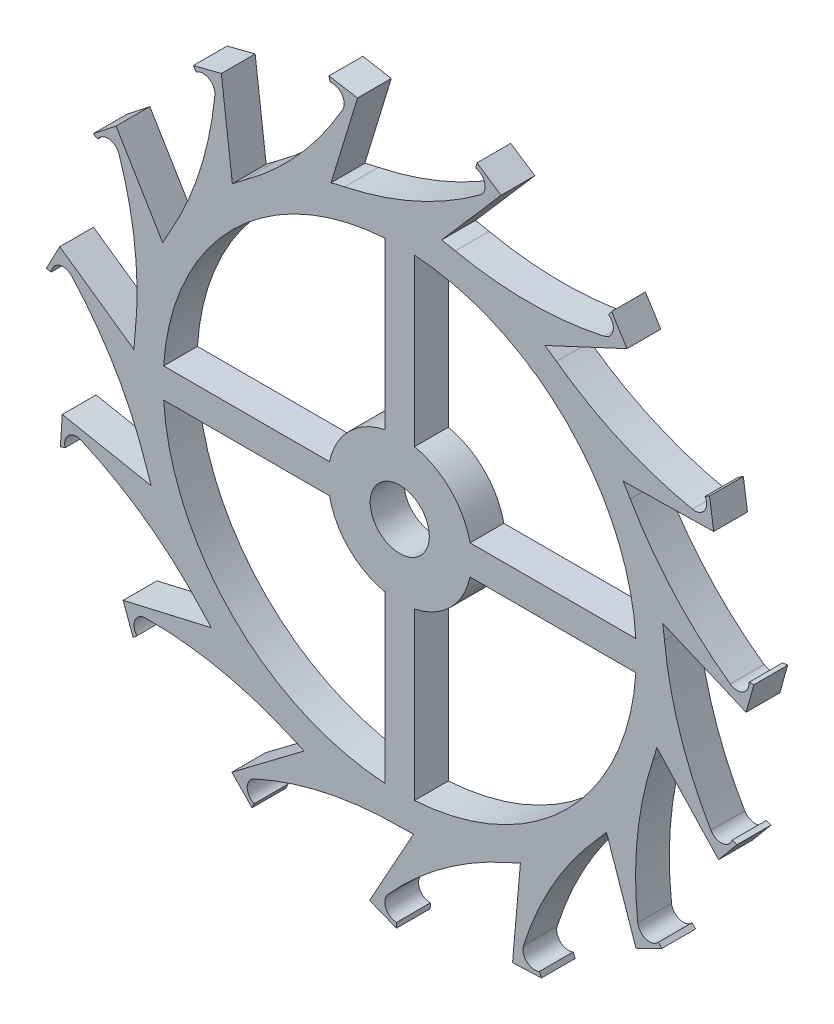
from build123d import *

# Parameters (mm, degrees)
SKETCH1_R           = 0.35
BOSS_EXTRUDE1_DEPTH = 0.4


with BuildPart() as part:
    # Sketch1 → Boss-Extrude1 (new body)
    with BuildSketch(Plane.XY):
        with BuildLine():
            Line((1.717219809, 2.640768094), (2.689842019, 3.094309279))
            Line((2.689842019, 3.094309279), (2.507060643, 3.38396102))
            Line((2.507060643, 3.38396102), (2.4713431, 3.33575047))
            ThreePointArc((2.4713431, 3.33575047), (2.524919075, 3.194040009), (2.418160882, 3.086546159))
            ThreePointArc((2.418160882, 3.086546159), (1.538245687, 2.989134777), (0.657689973, 3.080575255))
            ThreePointArc((0.657689973, 3.080575255), (0.576375294, 3.096819581), (0.494661207, 3.110917918))
            Line((0.494661207, 3.110917918), (1.198723989, 3.920849499))
            Line((1.198723989, 3.920849499), (0.913932917, 4.111115649))
            Line((0.913932917, 4.111115649), (0.900912315, 4.052545486))
            ThreePointArc((0.900912315, 4.052545486), (1.007495241, 3.94487785), (0.953688466, 3.803254863))
            ThreePointArc((0.953688466, 3.803254863), (0.189466715, 3.356371385), (-0.65215315, 3.081752143))
            ThreePointArc((-0.65215315, 3.081752143), (-0.733044969, 3.063518414), (-0.813428812, 3.043161771))
            Line((-0.813428812, 3.043161771), (-0.499664308, 4.069439222))
            Line((-0.499664308, 4.069439222), (-0.837222113, 4.127421033))
            Line((-0.837222113, 4.127421033), (-0.825294394, 4.068618571))
            ThreePointArc((-0.825294394, 4.068618571), (-0.684133674, 4.013610473), (-0.675685349, 3.862346249))
            ThreePointArc((-0.675685349, 3.862346249), (-1.192072773, 3.143260888), (-1.84923307, 2.550066088))
            ThreePointArc((-1.84923307, 2.550066088), (-1.915715097, 2.500507082), (-1.9808696, 2.449215309))
            Line((-1.9808696, 2.449215309), (-2.111656107, 3.514385933))
            Line((-2.111656107, 3.514385933), (-2.443613834, 3.430057825))
            Line((-2.443613834, 3.430057825), (-2.408800204, 3.381190544))
            ThreePointArc((-2.408800204, 3.381190544), (-2.25746966, 3.388353383), (-2.18822703, 3.253602881))
            ThreePointArc((-2.18822703, 3.253602881), (-2.367492049, 2.386652029), (-2.726563791, 1.577450441))
            ThreePointArc((-2.726563791, 1.577450441), (-2.767140682, 1.505135359), (-2.805800038, 1.431777269))
            Line((-2.805800038, 1.431777269), (-3.358523382, 2.351663389))
            Line((-3.358523382, 2.351663389), (-3.627482524, 2.139606457))
            Line((-3.627482524, 2.139606457), (-3.575802576, 2.109123954))
            ThreePointArc((-3.575802576, 2.109123954), (-3.440468635, 2.17721921), (-3.322404377, 2.082282016))
            ThreePointArc((-3.322404377, 2.082282016), (-3.133550441, 1.217369352), (-3.132446863, 0.332079281))
            ThreePointArc((-3.132446863, 0.332079281), (-3.140102504, 0.249512058), (-3.14558216, 0.166771932))
            Line((-3.14558216, 0.166771932), (-4.024671452, 0.782316881))
            Line((-4.024671452, 0.782316881), (-4.18412653, 0.479197696))
            Line((-4.18412653, 0.479197696), (-4.124516198, 0.472370671))
            ThreePointArc((-4.124516198, 0.472370671), (-4.028579326, 0.589624057), (-3.882107824, 0.550915675))
            ThreePointArc((-3.882107824, 0.550915675), (-3.357789496, -0.162407546), (-2.996701415, -0.970711403))
            ThreePointArc((-2.996701415, -0.970711403), (-2.970112076, -1.049254144), (-2.941464549, -1.127069787))
            Line((-2.941464549, -1.127069787), (-3.994917266, -0.922299323))
            Line((-3.994917266, -0.922299323), (-4.017297048, -1.264068701))
            Line((-4.017297048, -1.264068701), (-3.960063499, -1.246059791))
            ThreePointArc((-3.960063499, -1.246059791), (-3.920112054, -1.099922453), (-3.770559561, -1.075708992))
            ThreePointArc((-3.770559561, -1.075708992), (-3.001436241, -1.514102704), (-2.342799068, -2.105657267))
            ThreePointArc((-2.342799068, -2.105657267), (-2.286562287, -2.166594772), (-2.228740996, -2.226030901))
            Line((-2.228740996, -2.226030901), (-3.274405591, -2.467441595))
            Line((-3.274405591, -2.467441595), (-3.15584041, -2.788766135))
            Line((-3.15584041, -2.788766135), (-3.110879844, -2.749035196))
            ThreePointArc((-3.110879844, -2.749035196), (-3.133821794, -2.599282378), (-3.007047295, -2.516333802))
            ThreePointArc((-3.007047295, -2.516333802), (-2.126107394, -2.603995748), (-1.283805479, -2.87651586))
            ThreePointArc((-1.283805479, -2.87651586), (-1.207645106, -2.909311482), (-1.130647877, -2.940091049))
            Line((-1.130647877, -2.940091049), (-1.987719443, -3.585940799))
            Line((-1.987719443, -3.585940799), (-1.748710296, -3.83126057))
            Line((-1.748710296, -3.83126057), (-1.723796804, -3.776677441))
            ThreePointArc((-1.723796804, -3.776677441), (-1.805665276, -3.649202766), (-1.723589234, -3.521861637))
            ThreePointArc((-1.723589234, -3.521861637), (-0.883155263, -3.243634272), (-0.002830259, -3.149998729))
            ThreePointArc((-0.002830259, -3.149998729), (0.080084884, -3.148981805), (0.162944532, -3.145782745))
            Line((0.162944532, -3.145782745), (-0.357338545, -4.084398262))
            Line((-0.357338545, -4.084398262), (-0.039212284, -4.211295246))
            Line((-0.039212284, -4.211295246), (-0.038653636, -4.151297847))
            ThreePointArc((-0.038653636, -4.151297847), (-0.165292828, -4.068142844), (-0.142106936, -3.9184276))
            ThreePointArc((-0.142106936, -3.9184276), (0.512502436, -3.322418962), (1.278634338, -2.8788182))
            ThreePointArc((1.278634338, -2.8788182), (1.353967471, -2.844164568), (1.42836235, -2.807540026))
            Line((1.42836235, -2.807540026), (1.334829433, -3.87662616))
            Line((1.334829433, -3.87662616), (1.677065887, -3.863158716))
            Line((1.677065887, -3.863158716), (1.653173097, -3.808121141))
            ThreePointArc((1.653173097, -3.808121141), (1.503660251, -3.783664066), (1.463946943, -3.637461833))
            ThreePointArc((1.463946943, -3.637461833), (1.819543808, -2.826727231), (2.339011442, -2.109863852))
            ThreePointArc((2.339011442, -2.109863852), (2.393736781, -2.047565438), (2.446803342, -1.98384813))
            Line((2.446803342, -1.98384813), (2.796193276, -2.998550177))
            Line((2.796193276, -2.998550177), (3.103364131, -2.847046948))
            Line((3.103364131, -2.847046948), (3.059151183, -2.806485695))
            ThreePointArc((3.059151183, -2.806485695), (2.912616813, -2.844955398), (2.816871095, -2.72754587))
            ThreePointArc((2.816871095, -2.72754587), (2.811969526, -1.842268681), (2.994952219, -0.976094876))
            ThreePointArc((2.994952219, -0.976094876), (3.019607256, -0.896923642), (3.042169808, -0.81713087))
            Line((3.042169808, -0.81713087), (3.774069899, -1.601997627))
            Line((3.774069899, -1.601997627), (3.993062523, -1.338654898))
            Line((3.993062523, -1.338654898), (3.936174238, -1.319583375))
            ThreePointArc((3.936174238, -1.319583375), (3.817955468, -1.414328096), (3.682732645, -1.346012447))
            ThreePointArc((3.682732645, -1.346012447), (3.318180166, -0.53926514), (3.133038549, 0.326449772))
            ThreePointArc((3.133038549, 0.326449772), (3.123360204, 0.4088044), (3.111517477, 0.490875741))
            Line((3.111517477, 0.490875741), (4.09937555, 0.071554866))
            Line((4.09937555, 0.071554866), (4.19232413, 0.401202745))
            Line((4.19232413, 0.401202745), (4.132597008, 0.395486898))
            ThreePointArc((4.132597008, 0.395486898), (4.063134937, 0.260849383), (3.911816263, 0.268258756))
            ThreePointArc((3.911816263, 0.268258756), (3.250647311, 0.856982243), (2.72939405, 1.572548288))
            ThreePointArc((2.72939405, 1.572548288), (2.687055797, 1.643846447), (2.642855506, 1.714005476))
            Line((2.642855506, 1.714005476), (3.715861927, 1.732734873))
            Line((3.715861927, 1.732734873), (3.666694808, 2.071688789))
            Line((3.666694808, 2.071688789), (3.614456212, 2.042173893))
            ThreePointArc((3.614456212, 2.042173893), (3.605761463, 1.890923633), (3.464511313, 1.836145584))
            ThreePointArc((3.464511313, 1.836145584), (2.621048005, 2.105049611), (1.853812525, 2.546738919))
            ThreePointArc((1.853812525, 2.546738919), (1.786135033, 2.59465251), (1.717219809, 2.640768094))
        make_face()
        with BuildLine():
            ThreePointArc((-0.831790238, -0.175), (-0.601040764, -0.601040764), (-0.175, -0.831790238))
            Line((-0.175, -0.831790238), (-0.175, -2.794525899))
            ThreePointArc((-0.175, -2.794525899), (-1.979898987, -1.979898987), (-2.794525899, -0.175))
            Line((-2.794525899, -0.175), (-0.831790238, -0.175))
        make_face(mode=Mode.SUBTRACT)
        with BuildLine():
            ThreePointArc((0.175, -0.831790238), (0.601040764, -0.601040764), (0.831790238, -0.175))
            Line((0.831790238, -0.175), (2.794525899, -0.175))
            ThreePointArc((2.794525899, -0.175), (1.979898987, -1.979898987), (0.175, -2.794525899))
            Line((0.175, -2.794525899), (0.175, -0.831790238))
        make_face(mode=Mode.SUBTRACT)
        with BuildLine():
            Line((-0.175, 2.794525899), (-0.175, 0.831790238))
            ThreePointArc((-0.175, 0.831790238), (-0.601040764, 0.601040764), (-0.831790238, 0.175))
            Line((-0.831790238, 0.175), (-2.794525899, 0.175))
            ThreePointArc((-2.794525899, 0.175), (-1.979898987, 1.979898987), (-0.175, 2.794525899))
        make_face(mode=Mode.SUBTRACT)
        Circle(SKETCH1_R, mode=Mode.SUBTRACT)
        with BuildLine():
            Line((2.794525899, 0.175), (0.831790238, 0.175))
            ThreePointArc((0.831790238, 0.175), (0.601040764, 0.601040764), (0.175, 0.831790238))
            Line((0.175, 0.831790238), (0.175, 2.794525899))
            ThreePointArc((0.175, 2.794525899), (1.979898987, 1.979898987), (2.794525899, 0.175))
        make_face(mode=Mode.SUBTRACT)
    extrude(amount=BOSS_EXTRUDE1_DEPTH)


solid = part.part
